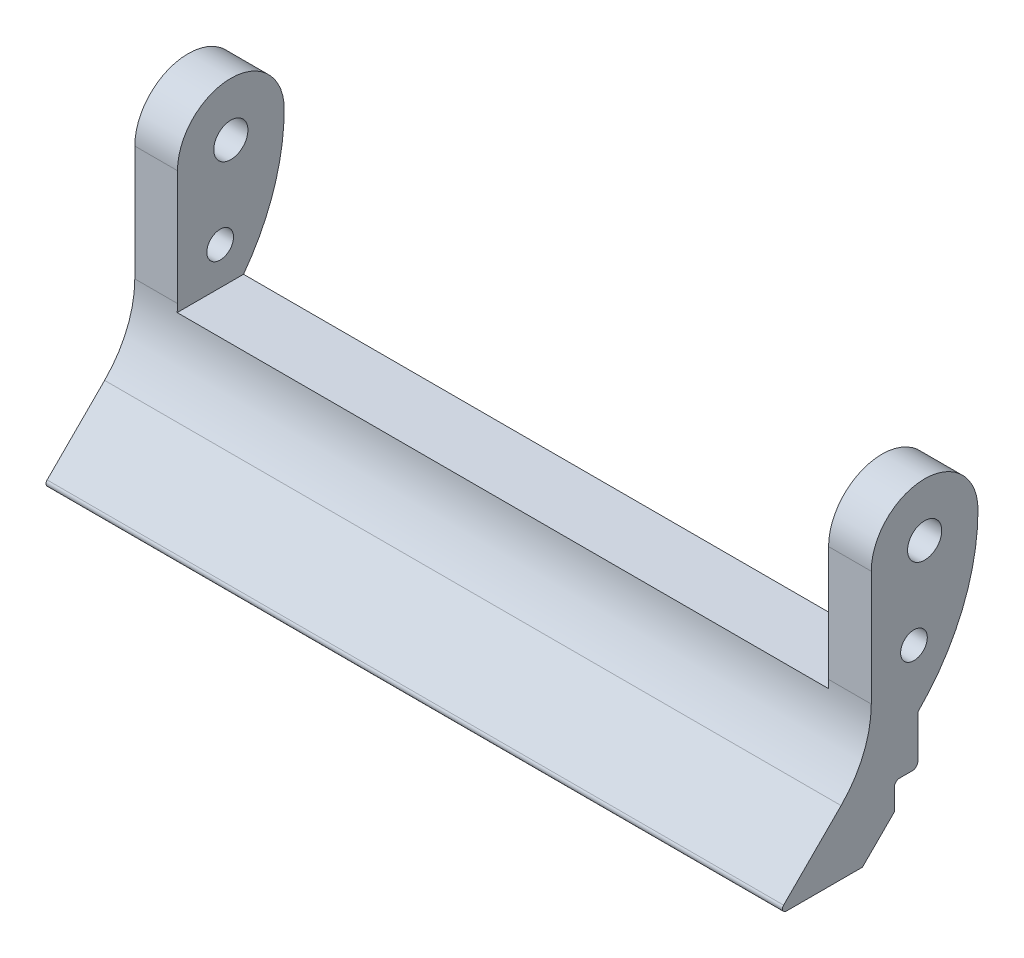
from build123d import *

# Parameters (mm, degrees)
SKETCH1_R               = 1.6
BOSS_EXTRUDE1_DEPTH     = 69
SKETCH2_W               = 21.169041722
SKETCH2_H               = 16.5
CUT_EXTRUDE1_DEPTH      = 61
TAP_DRILL_FOR_M3_TAP1_D = 2.5


with BuildPart() as part:
    # Sketch1 → Boss-Extrude1 (new body)
    with BuildSketch(Plane(origin=(0, 0, 0), x_dir=(0, 0, -1), z_dir=(1, 0, 0))):
        with BuildLine():
            Line((-5, 23.6), (-5, 12.823580437))
            ThreePointArc((-5, 12.823580437), (-5.734562511, 9.130685315), (-7.826419562, 5.999999999))
            Line((-7.826419562, 5.999999999), (-13.211861119, 0.614558441))
            ThreePointArc((-13.211861119, 0.614558441), (-13.28989931, 0.222233964), (-12.957302678, 0))
            Line((-12.957302678, 0), (-5.826419558, 0))
            Line((-5.826419558, 0), (-2.840921838, 2.98549772))
            Line((-2.840921838, 2.98549772), (-2.840921838, 4.98549772))
            ThreePointArc((-2.840921838, 4.98549772), (-2.694475228, 5.339051111), (-2.340921838, 5.48549772))
            Line((-2.340921838, 5.48549772), (-1.139311489, 5.48549772))
            ThreePointArc((-1.139311489, 5.48549772), (-0.785758099, 5.631944329), (-0.639311489, 5.98549772))
            Line((-0.639311489, 5.98549772), (-0.639311489, 9.98549772))
            ThreePointArc((-0.639311489, 9.98549772), (3.534390695, 16.231884461), (5, 23.6))
            ThreePointArc((5, 23.6), (0, 28.6), (-5, 23.6))
        make_face()
        with Locations((0, 23.6)):
            Circle(SKETCH1_R, mode=Mode.SUBTRACT)
    extrude(amount=BOSS_EXTRUDE1_DEPTH)

    # Sketch2 → Cut-Extrude1 (cut)
    with BuildSketch(Plane(origin=(4, 0, 0), x_dir=(0, 0, -1), z_dir=(1, 0, 0))):
        with Locations((-5.584520861, 20.35)):
            Rectangle(SKETCH2_W, SKETCH2_H)
    extrude(amount=CUT_EXTRUDE1_DEPTH, mode=Mode.SUBTRACT)

    # Tap Drill for M3 Tap1 (through all)
    with Locations(Plane(origin=(69, 0, 0), x_dir=(0, 0, -1), z_dir=(1, 0, 0))):
        with Locations((-1, 15.6)):
            Hole(TAP_DRILL_FOR_M3_TAP1_D / 2)


solid = part.part
